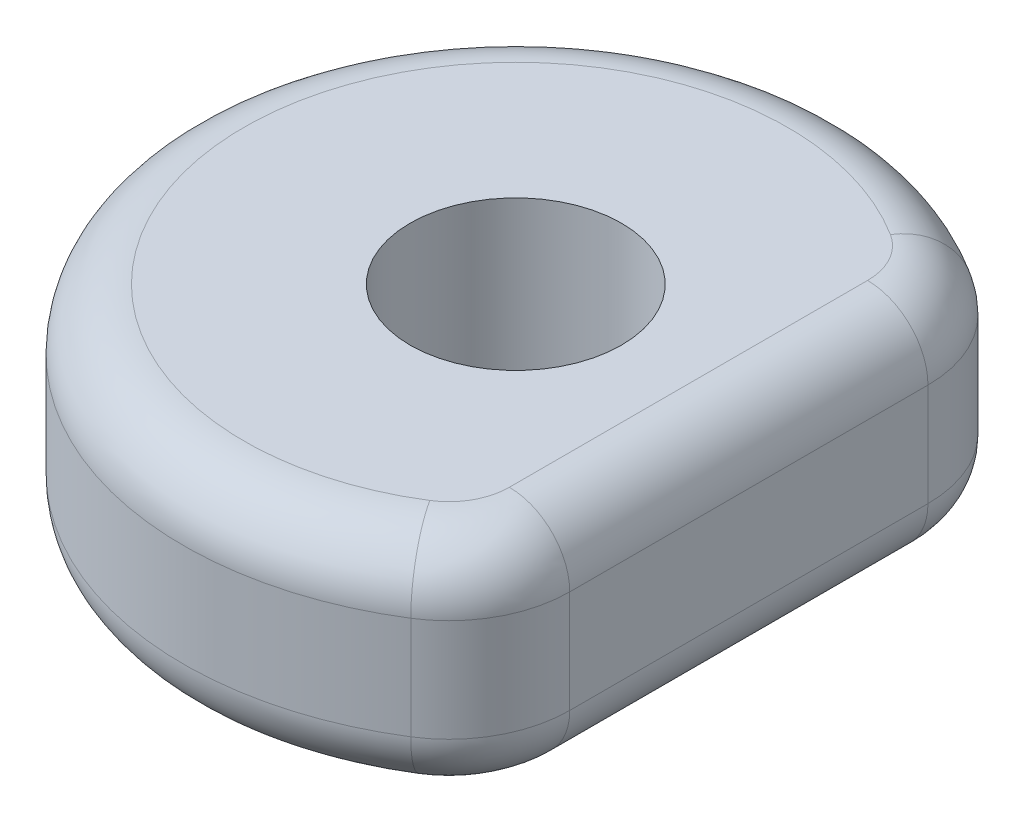
from build123d import *

# Parameters (mm, degrees)
CROQUIS1_R              = 1.75
SALIENTE_EXTRUIR1_DEPTH = 3.7
REDONDEO1_R             = 2
REDONDEO2_R             = 1


with BuildPart() as part:
    # Croquis1 → Saliente-Extruir1 (new body)
    with BuildSketch(Plane(origin=(0, 0, 0), x_dir=(1, 0, 0), z_dir=(0, 1, 0))):
        with BuildLine():
            Line((3.858987824, 3.918955597), (3.858987824, -3.918955597))
            ThreePointArc((3.858987824, -3.918955597), (-5.5, 0), (3.858987824, 3.918955597))
        make_face()
        with Locations(Location((0, 0, 0), (0, 0, 270))):
            Circle(CROQUIS1_R, mode=Mode.SUBTRACT)
    extrude(amount=SALIENTE_EXTRUIR1_DEPTH)

    # Redondeo1
    redondeo1_edges = [part.edges().sort_by_distance(p)[0] for p in [
        (3.858987824, 1.85, -3.918955597),
        (3.858987824, 1.85, 3.918955597),
    ]]
    fillet(redondeo1_edges, radius=REDONDEO1_R)

    # Redondeo2
    redondeo2_edges = [part.edges().sort_by_distance(p)[0] for p in [
        (3.858987824, 0, 0),
        (3.858987824, 3.7, 0),
        (-5.5, 0, 0),
        (3.60892461, 0, -3.933855699),
        (3.60892461, 0, 3.933855699),
        (-5.5, 3.7, 0),
        (3.60892461, 3.7, -3.933855699),
        (3.60892461, 3.7, 3.933855699),
    ]]
    fillet(redondeo2_edges, radius=REDONDEO2_R)


solid = part.part
